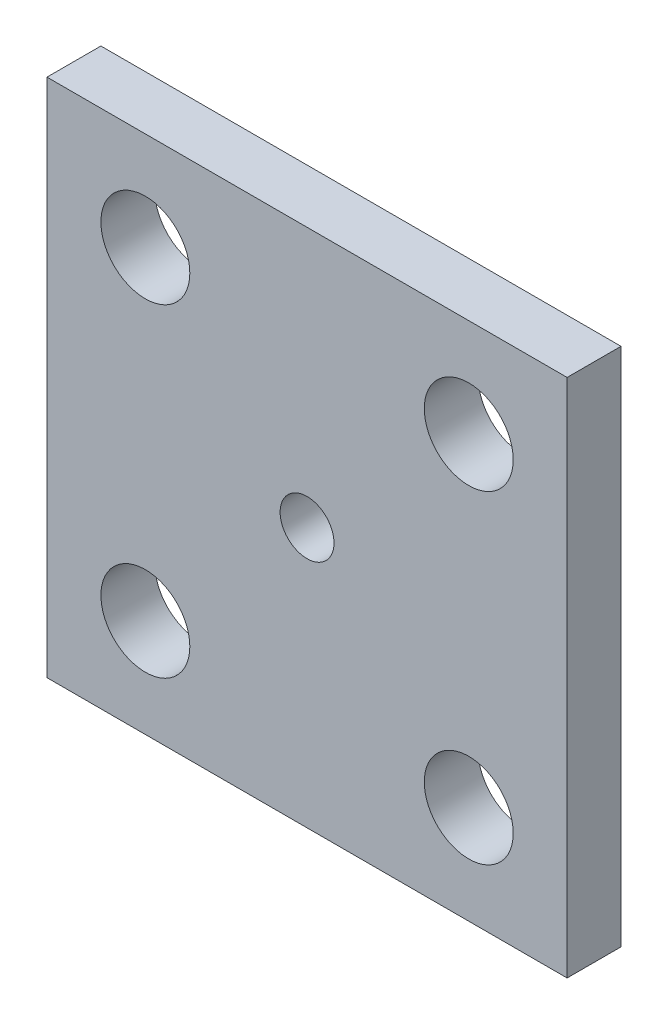
from build123d import *

# Parameters (mm, degrees)
SKETCH1_W           = 48.25
SKETCH1_H           = 48.25
SKETCH1_R           = 2.5
SKETCH1_R_2         = 4.125
BOSS_EXTRUDE1_DEPTH = 5


with BuildPart() as part:
    # Sketch1 → Boss-Extrude1 (new body)
    # profile 1 of 5: a face of its own
    with BuildSketch(Plane.XY):
        with Locations((24.125, 24.125)):
            Rectangle(SKETCH1_W, SKETCH1_H)
        with Locations((24.125, 24.125)):
            Circle(SKETCH1_R, mode=Mode.SUBTRACT)
        Polygon((34.895909278, 1.8), (30.666818556, 9.125), (34.895909278, 16.45), (43.354090722, 16.45), (47.583181444, 9.125), (43.354090722, 1.8), align=None, mode=Mode.SUBTRACT)
        Polygon((13.354090722, 1.8), (17.583181444, 9.125), (13.354090722, 16.45), (4.895909278, 16.45), (0.666818556, 9.125), (4.895909278, 1.8), align=None, mode=Mode.SUBTRACT)
        Polygon((34.895909278, 31.8), (43.354090722, 31.8), (47.583181444, 39.125), (43.354090722, 46.45), (34.895909278, 46.45), (30.666818556, 39.125), align=None, mode=Mode.SUBTRACT)
        Polygon((17.583181444, 39.125), (13.354090722, 31.8), (4.895909278, 31.8), (0.666818556, 39.125), (4.895909278, 46.45), (13.354090722, 46.45), align=None, mode=Mode.SUBTRACT)
    # profile 2 of 5: a face of its own
    with BuildSketch(Plane.XY):
        Polygon((30.666818556, 39.125), (34.895909278, 31.8), (43.354090722, 31.8), (47.583181444, 39.125), (43.354090722, 46.45), (34.895909278, 46.45), align=None)
        with Locations((39.125, 39.125)):
            Circle(SKETCH1_R_2, mode=Mode.SUBTRACT)
    # profile 3 of 5: a face of its own
    with BuildSketch(Plane.XY):
        Polygon((30.666818556, 9.125), (34.895909278, 16.45), (43.354090722, 16.45), (47.583181444, 9.125), (43.354090722, 1.8), (34.895909278, 1.8), align=None)
        with Locations((39.125, 9.125)):
            Circle(SKETCH1_R_2, mode=Mode.SUBTRACT)
    # profile 4 of 5: a face of its own
    with BuildSketch(Plane.XY):
        Polygon((4.895909278, 1.8), (13.354090722, 1.8), (17.583181444, 9.125), (13.354090722, 16.45), (4.895909278, 16.45), (0.666818556, 9.125), align=None)
        with Locations((9.125, 9.125)):
            Circle(SKETCH1_R_2, mode=Mode.SUBTRACT)
    # profile 5 of 5: a face of its own
    with BuildSketch(Plane.XY):
        Polygon((13.354090722, 31.8), (4.895909278, 31.8), (0.666818556, 39.125), (4.895909278, 46.45), (13.354090722, 46.45), (17.583181444, 39.125), align=None)
        with Locations((9.125, 39.125)):
            Circle(SKETCH1_R_2, mode=Mode.SUBTRACT)
    extrude(amount=BOSS_EXTRUDE1_DEPTH)


solid = part.part
